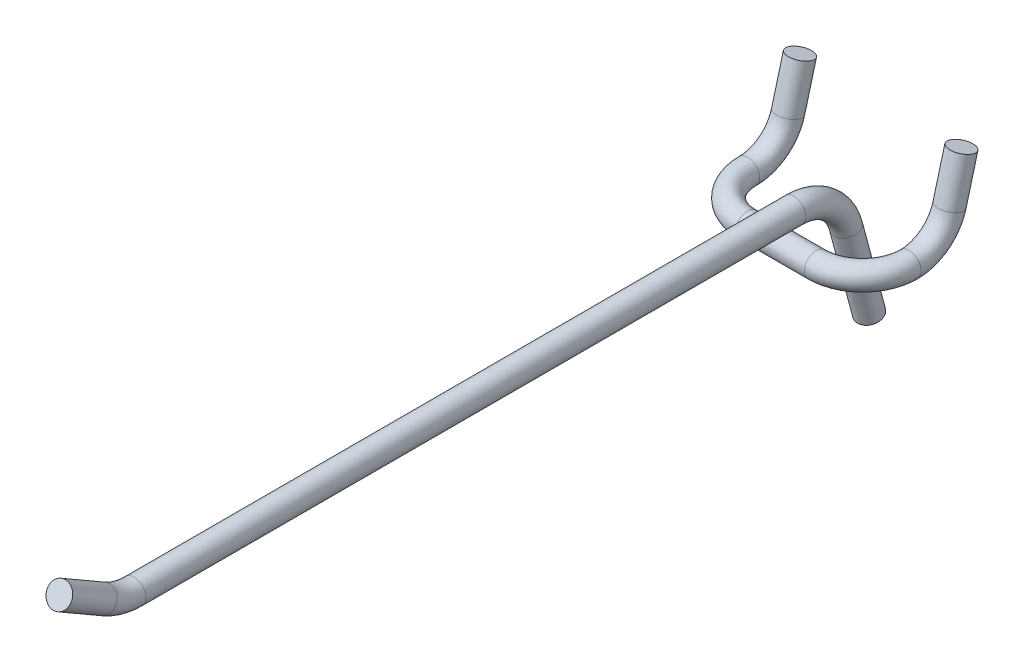
from build123d import *

# Parameters (mm, degrees)
SKETCH11_R       = 1.8796
SWEEP2_PROFILE_R = 1.8796


with BuildPart() as part:
    # Sweep1: sweep along a path in Sketch3
    with BuildLine(Plane(origin=(0, 0, 0), x_dir=(0, 0, -1), z_dir=(1, 0, 0))) as sweep1_path:
        Line((61.934325135, -18.57375), (58.26400614, -4.87593303))
        ThreePointArc((58.26400614, -4.87593303), (55.914364436, -1.359445716), (51.909566499, 0))
        Line((51.909566499, 0), (-51.909566499, 0))
        ThreePointArc((-51.909566499, 0), (-54.854720177, 0.387736837), (-57.599166499, 1.524523725))
        Line((-57.599166499, 1.524523725), (-64.609566499, 5.571980052))
    # Sketch11 → Sweep1 (sweep)
    with BuildSketch(Plane(origin=(0, -32.813125956, -8.792250601), x_dir=(0, 0.25881904510251613, -0.9659258262890696), z_dir=(0, -0.9659258262890696, -0.25881904510251613))):
        with Locations((56.896323943, 0)):
            Circle(SKETCH11_R)
    sweep(path=sweep1_path.line)


with BuildPart() as body_2:
    # Sweep2: sweep along a curve in space
    with BuildLine() as sweep2_path:
        Line((-12.7, 10.00125, -65.565433501), (-12.7, 2.99633303, -63.688471656))
        ThreePointArc((-12.7, 2.99633303, -63.688471656), (-12.7, -0.520154284, -61.338829952), (-12.7, -1.8796, -57.334032015))
        ThreePointArc((-12.7, -1.8796, -57.334032015), (-10.560688741, -1.8796, -52.169277758), (-5.395934484, -1.8796, -50.029966499))
        Line((-5.395934484, -1.8796, -50.029966499), (5.395934484, -1.8796, -50.029966499))
        ThreePointArc((5.395934484, -1.8796, -50.029966499), (10.560688741, -1.8796, -52.169277758), (12.7, -1.8796, -57.334032015))
        ThreePointArc((12.7, -1.8796, -57.334032015), (12.7, -0.520154284, -61.338829952), (12.7, 2.99633303, -63.688471656))
        Line((12.7, 2.99633303, -63.688471656), (12.7, 10.00125, -65.565433501))
    # Sweep2 profile (on start of the path) → Sweep2 (sweep)
    with BuildSketch(Plane(origin=(-12.7, 10.00125, -65.565433501), x_dir=(0, -0.25881904510251724, -0.9659258262890693), z_dir=(0, -0.9659258262890693, 0.25881904510251724))):
        Circle(SWEEP2_PROFILE_R)
    sweep(path=sweep2_path.line)


solid = Compound([part.part, body_2.part])
